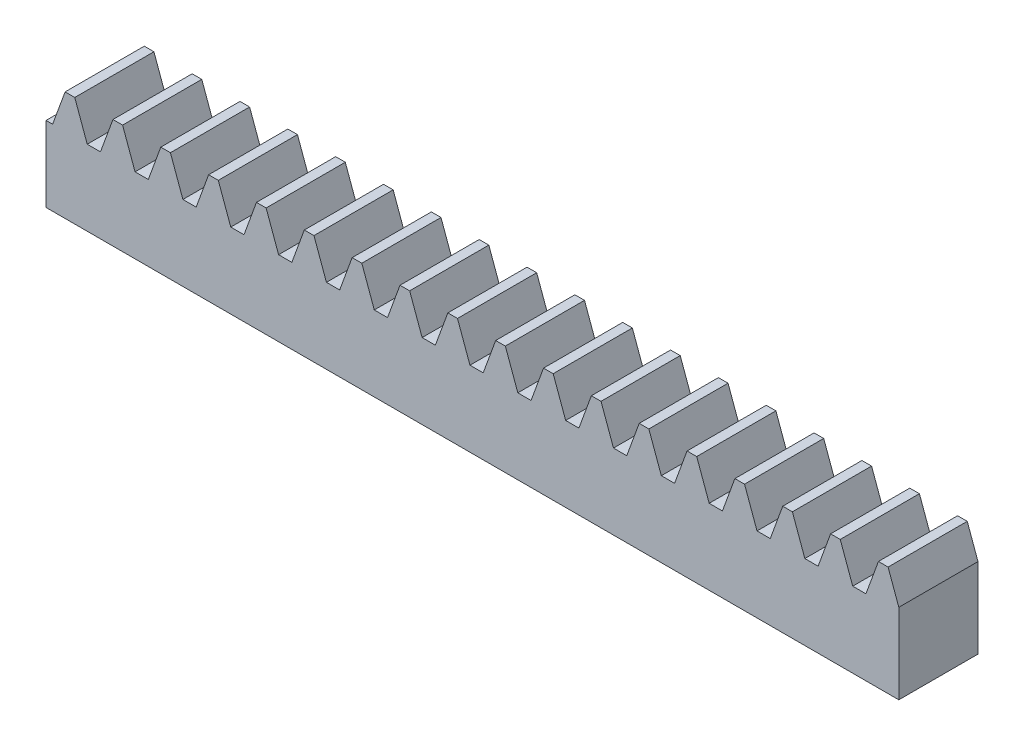
from build123d import *

# Parameters (mm, degrees)
BLANKSKE_W         = 140
BLANKSKE_H         = 18
BLANK_DEPTH        = 15
TOOTHCUTSIM_DEPTH  = 142.947173272
TEETHCUTS_COUNT    = 19
TEETHCUTS_PITCH    = 7.853981625
SKETCH1_W          = 155.727496732
SKETCH1_H          = 72.883147076
CUT_EXTRUDE2_DEPTH = 2


with BuildPart() as part:
    # BlankSke → Blank (new body)
    with BuildSketch(Plane.XY):
        with Locations((70, 9)):
            Rectangle(BLANKSKE_W, BLANKSKE_H)
    extrude(amount=-BLANK_DEPTH)

    # TooCutSkeSim → ToothCutSim (cut, through all)
    with BuildSketch(Plane.XY):
        Polygon((1.087088424, 12.375), (-1.087088424, 12.375), (-3.143665836, 18.0254), (3.143665836, 18.0254), align=None)
    toothcutsim = extrude(amount=-TOOTHCUTSIM_DEPTH, mode=Mode.SUBTRACT)

    # TeethCuts: ToothCutSim ×19
    with Locations(*[(i * TEETHCUTS_PITCH, 0, 0) for i in range(1, TEETHCUTS_COUNT)]):
        add(toothcutsim, mode=Mode.SUBTRACT)

    # Sketch1 → Cut-Extrude2 (cut)
    with BuildSketch(Plane.XY.offset(-15)):
        with Locations((71.044371672, 7.444354081)):
            Rectangle(SKETCH1_W, SKETCH1_H)
    extrude(amount=CUT_EXTRUDE2_DEPTH, mode=Mode.SUBTRACT)


solid = part.part
